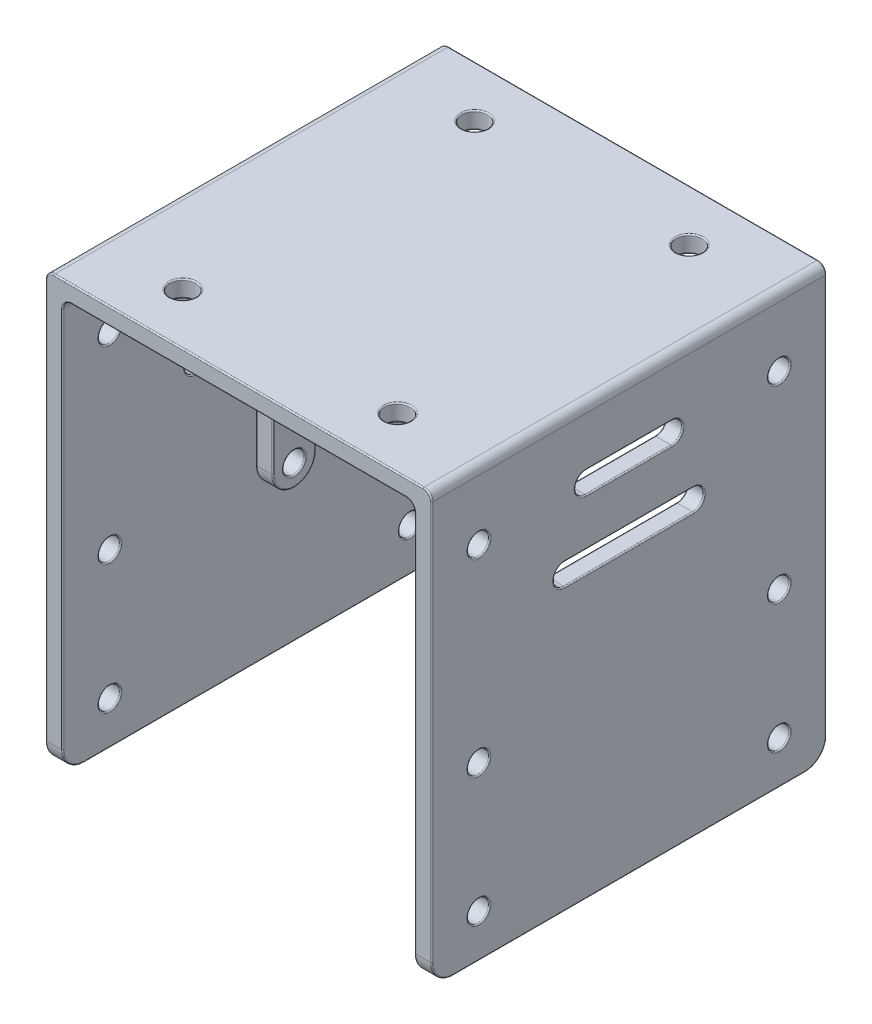
from build123d import *

# Parameters (mm, degrees)
BOSS_EXTRUDE1_DEPTH            = 23
BOSS_EXTRUDE1_DEPTH_BACK       = 23
SKETCH2_R                      = 1.5
CUT_EXTRUDE1_DEPTH             = 2
CUT_EXTRUDE2_REACH             = 61.458
SKETCH3_R                      = 1.25
CUT_EXTRUDE2_DIRECTION_2_REACH = 61.458
CUT_EXTRUDE3_REACH             = 61.458
CUT_EXTRUDE3_DIRECTION_2_REACH = 61.458
FILLET1_R                      = 2.5
FILLET2_R                      = 1
BOSS_EXTRUDE2_DEPTH            = 1
BOSS_EXTRUDE2_DEPTH_BACK       = 1
SKETCH5_R                      = 1.25
FILLET3_R                      = 0.15


with BuildPart() as part:
    # Sketch1 → Boss-Extrude1 (new, two sides: drawn at the far end of the back side and taken through both)
    with BuildSketch(Plane.XY.offset(-BOSS_EXTRUDE1_DEPTH_BACK)):
        Polygon((-22.5, -50), (-22.5, 0), (22.5, 0), (22.5, -50), (20.5, -50), (20.5, -2), (-20.5, -2), (-20.5, -50), align=None)
    extrude(amount=BOSS_EXTRUDE1_DEPTH + BOSS_EXTRUDE1_DEPTH_BACK)

    # Sketch2 → Cut-Extrude1 (cut)
    with BuildSketch(Plane(origin=(0, 0, 0), x_dir=(1, 0, 0), z_dir=(0, 1, 0))):
        with Locations(Location((-12.5, 17, 0), (0, 0, 180))):
            Circle(SKETCH2_R)
        with Locations(Location((12.5, 17, 0), (0, 0, 180))):
            Circle(SKETCH2_R)
        with Locations(Location((12.5, -17, 0), (0, 0, 90))):
            Circle(SKETCH2_R)
        with Locations(Location((-12.5, -17, 0), (0, 0, 90))):
            Circle(SKETCH2_R)
    extrude(amount=-CUT_EXTRUDE1_DEPTH, mode=Mode.SUBTRACT)

    # Cut-Extrude2: up to this face of the body (flat: up to its plane)
    cut_extrude2_end = Plane(part.part.faces().sort_by_distance((-22.5, -25, 0))[0])
    # Sketch3 → Cut-Extrude2 (cut, up to the picked face)
    with BuildSketch(Plane(origin=(0, 0, 0), x_dir=(0, 0, -1), z_dir=(1, 0, 0)), mode=Mode.PRIVATE) as cut_extrude2_sk1:
        with Locations((-17.5, -8)):
            Circle(SKETCH3_R)
    cut_extrude2_tool1 = split(extrude(cut_extrude2_sk1.sketch, amount=-CUT_EXTRUDE2_REACH, mode=Mode.PRIVATE), bisect_by=cut_extrude2_end, keep=Keep.BOTH, mode=Mode.PRIVATE)
    # Sketch3 → Cut-Extrude2 (cut, up to the picked face)
    with BuildSketch(Plane(origin=(0, 0, 0), x_dir=(0, 0, -1), z_dir=(1, 0, 0)), mode=Mode.PRIVATE) as cut_extrude2_sk2:
        with Locations((-17.5, -30)):
            Circle(SKETCH3_R)
    cut_extrude2_tool2 = split(extrude(cut_extrude2_sk2.sketch, amount=-CUT_EXTRUDE2_REACH, mode=Mode.PRIVATE), bisect_by=cut_extrude2_end, keep=Keep.BOTH, mode=Mode.PRIVATE)
    # Sketch3 → Cut-Extrude2 (cut, up to the picked face)
    with BuildSketch(Plane(origin=(0, 0, 0), x_dir=(0, 0, -1), z_dir=(1, 0, 0)), mode=Mode.PRIVATE) as cut_extrude2_sk3:
        with Locations((-17.5, -45)):
            Circle(SKETCH3_R)
    cut_extrude2_tool3 = split(extrude(cut_extrude2_sk3.sketch, amount=-CUT_EXTRUDE2_REACH, mode=Mode.PRIVATE), bisect_by=cut_extrude2_end, keep=Keep.BOTH, mode=Mode.PRIVATE)
    # Sketch3 → Cut-Extrude2 (cut, up to the picked face)
    with BuildSketch(Plane(origin=(0, 0, 0), x_dir=(0, 0, -1), z_dir=(1, 0, 0)), mode=Mode.PRIVATE) as cut_extrude2_sk4:
        with Locations((17.5, -45)):
            Circle(SKETCH3_R)
    cut_extrude2_tool4 = split(extrude(cut_extrude2_sk4.sketch, amount=-CUT_EXTRUDE2_REACH, mode=Mode.PRIVATE), bisect_by=cut_extrude2_end, keep=Keep.BOTH, mode=Mode.PRIVATE)
    # Sketch3 → Cut-Extrude2 (cut, up to the picked face)
    with BuildSketch(Plane(origin=(0, 0, 0), x_dir=(0, 0, -1), z_dir=(1, 0, 0)), mode=Mode.PRIVATE) as cut_extrude2_sk5:
        with Locations((17.5, -30)):
            Circle(SKETCH3_R)
    cut_extrude2_tool5 = split(extrude(cut_extrude2_sk5.sketch, amount=-CUT_EXTRUDE2_REACH, mode=Mode.PRIVATE), bisect_by=cut_extrude2_end, keep=Keep.BOTH, mode=Mode.PRIVATE)
    # Sketch3 → Cut-Extrude2 (cut, up to the picked face)
    with BuildSketch(Plane(origin=(0, 0, 0), x_dir=(0, 0, -1), z_dir=(1, 0, 0)), mode=Mode.PRIVATE) as cut_extrude2_sk6:
        with Locations((17.5, -8)):
            Circle(SKETCH3_R)
    cut_extrude2_tool6 = split(extrude(cut_extrude2_sk6.sketch, amount=-CUT_EXTRUDE2_REACH, mode=Mode.PRIVATE), bisect_by=cut_extrude2_end, keep=Keep.BOTH, mode=Mode.PRIVATE)
    add(cut_extrude2_tool1.solids().sort_by(Axis((0, -8, 17.5), (-1, 0, 0)))[0], mode=Mode.SUBTRACT)
    add(cut_extrude2_tool2.solids().sort_by(Axis((0, -30, 17.5), (-1, 0, 0)))[0], mode=Mode.SUBTRACT)
    add(cut_extrude2_tool3.solids().sort_by(Axis((0, -45, 17.5), (-1, 0, 0)))[0], mode=Mode.SUBTRACT)
    add(cut_extrude2_tool4.solids().sort_by(Axis((0, -45, -17.5), (-1, 0, 0)))[0], mode=Mode.SUBTRACT)
    add(cut_extrude2_tool5.solids().sort_by(Axis((0, -30, -17.5), (-1, 0, 0)))[0], mode=Mode.SUBTRACT)
    add(cut_extrude2_tool6.solids().sort_by(Axis((0, -8, -17.5), (-1, 0, 0)))[0], mode=Mode.SUBTRACT)

    # Cut-Extrude2 direction 2: up to this face of the body (flat: up to its plane)
    cut_extrude2_direction_2_end = Plane(part.part.faces().sort_by_distance((22.5, -25, 0))[0])
    # Sketch3 → Cut-Extrude2 direction 2 (cut, up to the picked face)
    with BuildSketch(Plane(origin=(0, 0, 0), x_dir=(0, 0, -1), z_dir=(1, 0, 0)), mode=Mode.PRIVATE) as cut_extrude2_direction_2_sk1:
        with Locations((-17.5, -8)):
            Circle(SKETCH3_R)
    cut_extrude2_direction_2_tool1 = split(extrude(cut_extrude2_direction_2_sk1.sketch, amount=CUT_EXTRUDE2_DIRECTION_2_REACH, mode=Mode.PRIVATE), bisect_by=cut_extrude2_direction_2_end, keep=Keep.BOTH, mode=Mode.PRIVATE)
    # Sketch3 → Cut-Extrude2 direction 2 (cut, up to the picked face)
    with BuildSketch(Plane(origin=(0, 0, 0), x_dir=(0, 0, -1), z_dir=(1, 0, 0)), mode=Mode.PRIVATE) as cut_extrude2_direction_2_sk2:
        with Locations((-17.5, -30)):
            Circle(SKETCH3_R)
    cut_extrude2_direction_2_tool2 = split(extrude(cut_extrude2_direction_2_sk2.sketch, amount=CUT_EXTRUDE2_DIRECTION_2_REACH, mode=Mode.PRIVATE), bisect_by=cut_extrude2_direction_2_end, keep=Keep.BOTH, mode=Mode.PRIVATE)
    # Sketch3 → Cut-Extrude2 direction 2 (cut, up to the picked face)
    with BuildSketch(Plane(origin=(0, 0, 0), x_dir=(0, 0, -1), z_dir=(1, 0, 0)), mode=Mode.PRIVATE) as cut_extrude2_direction_2_sk3:
        with Locations((-17.5, -45)):
            Circle(SKETCH3_R)
    cut_extrude2_direction_2_tool3 = split(extrude(cut_extrude2_direction_2_sk3.sketch, amount=CUT_EXTRUDE2_DIRECTION_2_REACH, mode=Mode.PRIVATE), bisect_by=cut_extrude2_direction_2_end, keep=Keep.BOTH, mode=Mode.PRIVATE)
    # Sketch3 → Cut-Extrude2 direction 2 (cut, up to the picked face)
    with BuildSketch(Plane(origin=(0, 0, 0), x_dir=(0, 0, -1), z_dir=(1, 0, 0)), mode=Mode.PRIVATE) as cut_extrude2_direction_2_sk4:
        with Locations((17.5, -45)):
            Circle(SKETCH3_R)
    cut_extrude2_direction_2_tool4 = split(extrude(cut_extrude2_direction_2_sk4.sketch, amount=CUT_EXTRUDE2_DIRECTION_2_REACH, mode=Mode.PRIVATE), bisect_by=cut_extrude2_direction_2_end, keep=Keep.BOTH, mode=Mode.PRIVATE)
    # Sketch3 → Cut-Extrude2 direction 2 (cut, up to the picked face)
    with BuildSketch(Plane(origin=(0, 0, 0), x_dir=(0, 0, -1), z_dir=(1, 0, 0)), mode=Mode.PRIVATE) as cut_extrude2_direction_2_sk5:
        with Locations((17.5, -30)):
            Circle(SKETCH3_R)
    cut_extrude2_direction_2_tool5 = split(extrude(cut_extrude2_direction_2_sk5.sketch, amount=CUT_EXTRUDE2_DIRECTION_2_REACH, mode=Mode.PRIVATE), bisect_by=cut_extrude2_direction_2_end, keep=Keep.BOTH, mode=Mode.PRIVATE)
    # Sketch3 → Cut-Extrude2 direction 2 (cut, up to the picked face)
    with BuildSketch(Plane(origin=(0, 0, 0), x_dir=(0, 0, -1), z_dir=(1, 0, 0)), mode=Mode.PRIVATE) as cut_extrude2_direction_2_sk6:
        with Locations((17.5, -8)):
            Circle(SKETCH3_R)
    cut_extrude2_direction_2_tool6 = split(extrude(cut_extrude2_direction_2_sk6.sketch, amount=CUT_EXTRUDE2_DIRECTION_2_REACH, mode=Mode.PRIVATE), bisect_by=cut_extrude2_direction_2_end, keep=Keep.BOTH, mode=Mode.PRIVATE)
    add(cut_extrude2_direction_2_tool1.solids().sort_by(Axis((0, -8, 17.5), (1, 0, 0)))[0], mode=Mode.SUBTRACT)
    add(cut_extrude2_direction_2_tool2.solids().sort_by(Axis((0, -30, 17.5), (1, 0, 0)))[0], mode=Mode.SUBTRACT)
    add(cut_extrude2_direction_2_tool3.solids().sort_by(Axis((0, -45, 17.5), (1, 0, 0)))[0], mode=Mode.SUBTRACT)
    add(cut_extrude2_direction_2_tool4.solids().sort_by(Axis((0, -45, -17.5), (1, 0, 0)))[0], mode=Mode.SUBTRACT)
    add(cut_extrude2_direction_2_tool5.solids().sort_by(Axis((0, -30, -17.5), (1, 0, 0)))[0], mode=Mode.SUBTRACT)
    add(cut_extrude2_direction_2_tool6.solids().sort_by(Axis((0, -8, -17.5), (1, 0, 0)))[0], mode=Mode.SUBTRACT)

    # Cut-Extrude3: up to this face of the body (flat: up to its plane)
    cut_extrude3_end = Plane(part.part.faces().sort_by_distance((-22.5, -24.965409306, 0))[0])
    # Sketch4 → Cut-Extrude3 (cut, up to the picked face)
    with BuildSketch(Plane(origin=(0, 0, 0), x_dir=(0, 0, -1), z_dir=(1, 0, 0)), mode=Mode.PRIVATE) as cut_extrude3_sk1:
        with BuildLine():
            Line((-5, -6.75), (5, -6.75))
            ThreePointArc((5, -6.75), (6.25, -8), (5, -9.25))
            Line((5, -9.25), (-5, -9.25))
            ThreePointArc((-5, -9.25), (-6.25, -8), (-5, -6.75))
        make_face()
    cut_extrude3_tool1 = split(extrude(cut_extrude3_sk1.sketch, amount=-CUT_EXTRUDE3_REACH, mode=Mode.PRIVATE), bisect_by=cut_extrude3_end, keep=Keep.BOTH, mode=Mode.PRIVATE)
    # Sketch4 → Cut-Extrude3 (cut, up to the picked face)
    with BuildSketch(Plane(origin=(0, 0, 0), x_dir=(0, 0, -1), z_dir=(1, 0, 0)), mode=Mode.PRIVATE) as cut_extrude3_sk2:
        with BuildLine():
            Line((-7.5, -14.75), (7.5, -14.75))
            ThreePointArc((7.5, -14.75), (8.75, -16), (7.5, -17.25))
            Line((7.5, -17.25), (-7.5, -17.25))
            ThreePointArc((-7.5, -17.25), (-8.75, -16), (-7.5, -14.75))
        make_face()
    cut_extrude3_tool2 = split(extrude(cut_extrude3_sk2.sketch, amount=-CUT_EXTRUDE3_REACH, mode=Mode.PRIVATE), bisect_by=cut_extrude3_end, keep=Keep.BOTH, mode=Mode.PRIVATE)
    add(cut_extrude3_tool1.solids().sort_by(Axis((0, -8, 0), (-1, 0, 0)))[0], mode=Mode.SUBTRACT)
    add(cut_extrude3_tool2.solids().sort_by(Axis((0, -16, 0), (-1, 0, 0)))[0], mode=Mode.SUBTRACT)

    # Cut-Extrude3 direction 2: up to this face of the body (flat: up to its plane)
    cut_extrude3_direction_2_end = Plane(part.part.faces().sort_by_distance((22.5, -24.965409306, 0))[0])
    # Sketch4 → Cut-Extrude3 direction 2 (cut, up to the picked face)
    with BuildSketch(Plane(origin=(0, 0, 0), x_dir=(0, 0, -1), z_dir=(1, 0, 0)), mode=Mode.PRIVATE) as cut_extrude3_direction_2_sk1:
        with BuildLine():
            Line((-5, -6.75), (5, -6.75))
            ThreePointArc((5, -6.75), (6.25, -8), (5, -9.25))
            Line((5, -9.25), (-5, -9.25))
            ThreePointArc((-5, -9.25), (-6.25, -8), (-5, -6.75))
        make_face()
    cut_extrude3_direction_2_tool1 = split(extrude(cut_extrude3_direction_2_sk1.sketch, amount=CUT_EXTRUDE3_DIRECTION_2_REACH, mode=Mode.PRIVATE), bisect_by=cut_extrude3_direction_2_end, keep=Keep.BOTH, mode=Mode.PRIVATE)
    # Sketch4 → Cut-Extrude3 direction 2 (cut, up to the picked face)
    with BuildSketch(Plane(origin=(0, 0, 0), x_dir=(0, 0, -1), z_dir=(1, 0, 0)), mode=Mode.PRIVATE) as cut_extrude3_direction_2_sk2:
        with BuildLine():
            Line((-7.5, -14.75), (7.5, -14.75))
            ThreePointArc((7.5, -14.75), (8.75, -16), (7.5, -17.25))
            Line((7.5, -17.25), (-7.5, -17.25))
            ThreePointArc((-7.5, -17.25), (-8.75, -16), (-7.5, -14.75))
        make_face()
    cut_extrude3_direction_2_tool2 = split(extrude(cut_extrude3_direction_2_sk2.sketch, amount=CUT_EXTRUDE3_DIRECTION_2_REACH, mode=Mode.PRIVATE), bisect_by=cut_extrude3_direction_2_end, keep=Keep.BOTH, mode=Mode.PRIVATE)
    add(cut_extrude3_direction_2_tool1.solids().sort_by(Axis((0, -8, 0), (1, 0, 0)))[0], mode=Mode.SUBTRACT)
    add(cut_extrude3_direction_2_tool2.solids().sort_by(Axis((0, -16, 0), (1, 0, 0)))[0], mode=Mode.SUBTRACT)

    # Fillet1
    fillet1_edges = [part.edges().sort_by_distance(p)[0] for p in [
        (21.5, -50, -23),
        (-21.5, -50, 23),
        (21.5, -50, 23),
        (-21.5, -50, -23),
    ]]
    fillet(fillet1_edges, radius=FILLET1_R)

    # Fillet2
    fillet2_edges = [part.edges().sort_by_distance(p)[0] for p in [
        (-22.5, 0, 0),
        (22.5, 0, 0),
        (20.5, -2, 0),
        (-20.5, -2, 0),
    ]]
    fillet(fillet2_edges, radius=FILLET2_R)

    # Sketch5 → Boss-Extrude2 (add, two sides: drawn at the far end of the back side and taken through both)
    # profile 1 of 2: a face of its own
    with BuildSketch(Plane(origin=(0, 0, 0), x_dir=(0, 0, -1), z_dir=(1, 0, 0)).offset(-BOSS_EXTRUDE2_DEPTH_BACK)):
        with BuildLine():
            Line((-15, -10.5), (-15, -2))
            Line((-15, -2), (-20, -2))
            Line((-20, -2), (-20, -10.5))
            ThreePointArc((-20, -10.5), (-17.5, -13), (-15, -10.5))
        make_face()
        with Locations((-17.5, -10.5)):
            Circle(SKETCH5_R, mode=Mode.SUBTRACT)
    # profile 2 of 2: a face of its own
    with BuildSketch(Plane(origin=(0, 0, 0), x_dir=(0, 0, -1), z_dir=(1, 0, 0)).offset(-BOSS_EXTRUDE2_DEPTH_BACK)):
        with BuildLine():
            Line((20, -2), (15, -2))
            Line((15, -2), (15, -10.5))
            ThreePointArc((15, -10.5), (17.5, -13), (20, -10.5))
            Line((20, -10.5), (20, -2))
        make_face()
        with Locations(Location((17.5, -10.5, 0), (0, 0, 180))):
            Circle(SKETCH5_R, mode=Mode.SUBTRACT)
    extrude(amount=BOSS_EXTRUDE2_DEPTH + BOSS_EXTRUDE2_DEPTH_BACK)

    # Fillet3
    fillet3_edges = [part.edges().sort_by_distance(p)[0] for p in [
        (-20.5, -16, 8.75),
        (-20.5, -14.75, 0),
        (-20.5, -16, -8.75),
        (-20.5, -17.25, 0),
        (-20.5, -8, 6.25),
        (-20.5, -6.75, 0),
        (-20.5, -8, -6.25),
        (-20.5, -9.25, 0),
        (20.5, -9.25, 0),
        (20.5, -8, -6.25),
        (20.5, -6.75, 0),
        (20.5, -8, 6.25),
        (-22.5, -9.25, 0),
        (-22.5, -8, -6.25),
        (-22.5, -6.75, 0),
        (-22.5, -8, 6.25),
        (22.5, -6.75, 0),
        (22.5, -8, 6.25),
        (22.5, -9.25, 0),
        (22.5, -8, -6.25),
        (20.5, -17.25, 0),
        (20.5, -16, -8.75),
        (20.5, -14.75, 0),
        (20.5, -16, 8.75),
        (-22.5, -17.25, 0),
        (-22.5, -16, -8.75),
        (-22.5, -14.75, 0),
        (-22.5, -16, 8.75),
        (22.5, -14.75, 0),
        (22.5, -16, 8.75),
        (22.5, -17.25, 0),
        (22.5, -16, -8.75),
        (22.5, -50, 0),
        (20.5, -50, 0),
        (22.5, -24.25, 23),
        (22.5, -24.25, -23),
        (22.5, -49.267766953, 22.267766953),
        (22.5, -49.267766953, -22.267766953),
        (-20.5, -25.25, -23),
        (20.5, -49.267766953, 22.267766953),
        (20.5, -49.267766953, -22.267766953),
        (-20.5, -25.25, 23),
        (-20.5, -50, 0),
        (-22.5, -50, 0),
        (-20.5, -49.267766953, 22.267766953),
        (-20.5, -49.267766953, -22.267766953),
        (-22.5, -49.267766953, 22.267766953),
        (-22.5, -49.267766953, -22.267766953),
        (0, -2, 23),
        (0, -2, -23),
        (20.5, -25.25, -23),
        (20.5, -25.25, 23),
        (0, 0, 23),
        (0, 0, -23),
        (-22.5, -24.25, 23),
        (22.207106781, -0.292893219, 23),
        (-22.207106781, -0.292893219, 23),
        (-22.5, -24.25, -23),
        (22.207106781, -0.292893219, -23),
        (-22.207106781, -0.292893219, -23),
        (-20.207106781, -2.292893219, 23),
        (-20.207106781, -2.292893219, -23),
        (20.207106781, -2.292893219, 23),
        (20.207106781, -2.292893219, -23),
        (-1, -13, 17.5),
        (-1, -6.25, 20),
        (0, -2, 20),
        (-1, -2, 17.5),
        (0, -2, 15),
        (-1, -6.25, 15),
        (-1, -10.5, 18.75),
        (1, -10.5, 18.75),
        (1, -13, 17.5),
        (1, -6.25, 15),
        (1, -2, 17.5),
        (1, -6.25, 20),
        (-1, -13, -17.5),
        (-1, -6.25, -15),
        (0, -2, -15),
        (-1, -2, -17.5),
        (0, -2, -20),
        (-1, -6.25, -20),
        (-1, -10.5, -18.75),
        (1, -10.5, -18.75),
        (1, -13, -17.5),
        (1, -6.25, -20),
        (1, -2, -17.5),
        (1, -6.25, -15),
        (-12.5, 0, 18.5),
        (-12.5, -2, 18.5),
        (12.5, 0, 18.5),
        (12.5, -2, 18.5),
        (14, 0, -17),
        (14, -2, -17),
        (-11, 0, -17),
        (-11, -2, -17),
        (-20.5, -8, -16.25),
        (20.5, -8, -16.25),
        (-22.5, -8, -16.25),
        (22.5, -8, -16.25),
        (-20.5, -30, -16.25),
        (20.5, -30, -16.25),
        (-22.5, -30, -16.25),
        (22.5, -30, -16.25),
        (-20.5, -45, -16.25),
        (20.5, -45, -16.25),
        (-22.5, -45, -16.25),
        (22.5, -45, -16.25),
        (-20.5, -45, 18.75),
        (20.5, -45, 18.75),
        (-22.5, -45, 18.75),
        (22.5, -45, 18.75),
        (-20.5, -30, 18.75),
        (20.5, -30, 18.75),
        (-22.5, -30, 18.75),
        (22.5, -30, 18.75),
        (-20.5, -8, 18.75),
        (20.5, -8, 18.75),
        (-22.5, -8, 18.75),
        (22.5, -8, 18.75),
    ]]
    fillet(fillet3_edges, radius=FILLET3_R)


solid = part.part
